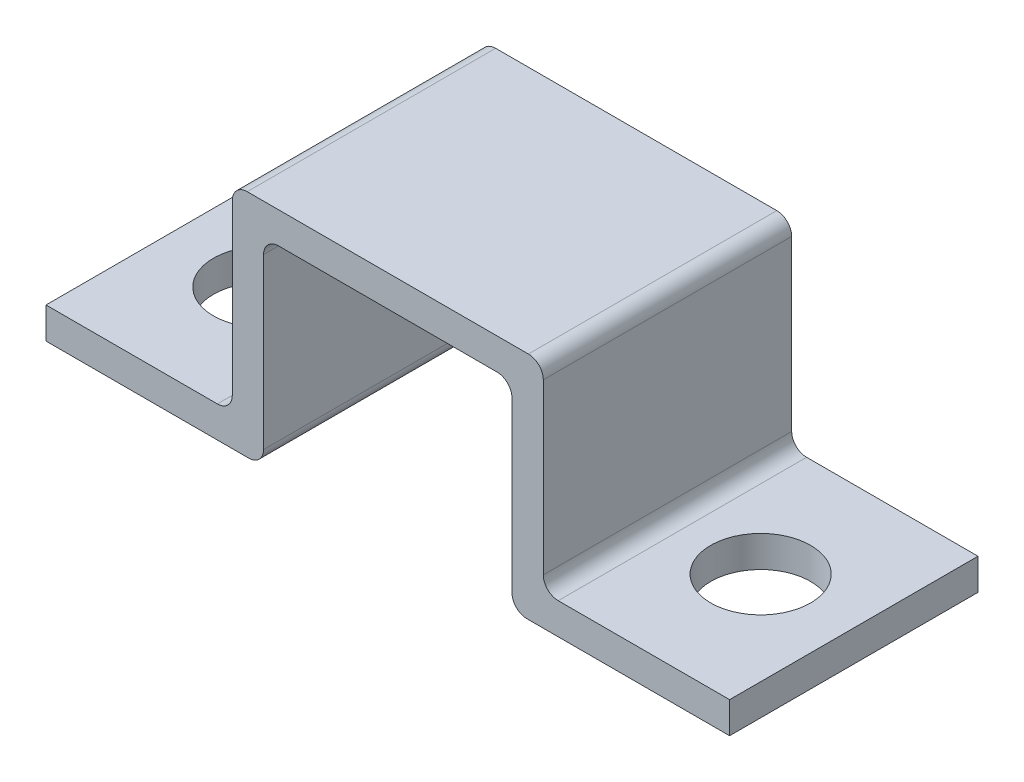
from build123d import *

# Parameters (mm, degrees)
SKETCH1_W           = 12.7
SKETCH1_H           = 12.7
BOSS_EXTRUDE1_DEPTH = 1.6002
SKETCH2_W           = 12.7
SKETCH2_H           = 11.7602
BOSS_EXTRUDE2_DEPTH = 1.6002
SKETCH3_W           = 12.7
SKETCH3_H           = 1.6002
BOSS_EXTRUDE3_DEPTH = 9.525
SKETCH4_R           = 2.5527
CUT_EXTRUDE1_DEPTH  = 22.187985158
FILLET1_R           = 0.762


with BuildPart() as part:
    # Sketch1 → Boss-Extrude1 (new body)
    with BuildSketch(Plane(origin=(0, 0, 0), x_dir=(1, 0, 0), z_dir=(0, 1, 0))):
        Rectangle(SKETCH1_W, SKETCH1_H)
    extrude(amount=BOSS_EXTRUDE1_DEPTH)

    # Sketch2 → Boss-Extrude2 (add)
    with BuildSketch(Plane(origin=(6.35, 0, 0), x_dir=(0, 0, -1), z_dir=(1, 0, 0))):
        with Locations((0, -4.2799)):
            Rectangle(SKETCH2_W, SKETCH2_H)
    boss_extrude2 = extrude(amount=BOSS_EXTRUDE2_DEPTH)

    # Sketch3 → Boss-Extrude3 (add)
    with BuildSketch(Plane(origin=(7.9502, 0, 0), x_dir=(0, 0, -1), z_dir=(1, 0, 0))):
        with Locations((0, -9.3599)):
            Rectangle(SKETCH3_W, SKETCH3_H)
    boss_extrude3 = extrude(amount=BOSS_EXTRUDE3_DEPTH)

    # Sketch4 → Cut-Extrude1 (cut, through all)
    with BuildSketch(Plane(origin=(0, -8.5598, 0), x_dir=(1, 0, 0), z_dir=(0, 1, 0))):
        with Locations(Location((12.7127, 0, 0), (0, 0, 270))):
            Circle(SKETCH4_R)
    cut_extrude1 = extrude(amount=-CUT_EXTRUDE1_DEPTH, mode=Mode.SUBTRACT)

    # Mirror2: Boss-Extrude2, Boss-Extrude3, Cut-Extrude1 across plane
    add(boss_extrude2.mirror(Plane(origin=(0, 0, 0), x_dir=(0, 0, 1), z_dir=(1, 0, 0))))
    add(boss_extrude3.mirror(Plane(origin=(0, 0, 0), x_dir=(0, 0, 1), z_dir=(1, 0, 0))))
    add(cut_extrude1.mirror(Plane(origin=(0, 0, 0), x_dir=(0, 0, 1), z_dir=(1, 0, 0))), mode=Mode.SUBTRACT)

    # Fillet1
    fillet1_edges = [part.edges().sort_by_distance(p)[0] for p in [
        (6.35, -10.16, 0),
        (-6.35, -10.16, 0),
        (6.35, 0, 0),
        (-6.35, 0, 0),
        (-7.9502, -8.5598, 0),
        (-7.9502, 1.6002, 0),
        (7.9502, 1.6002, 0),
        (7.9502, -8.5598, 0),
    ]]
    fillet(fillet1_edges, radius=FILLET1_R)


solid = part.part
